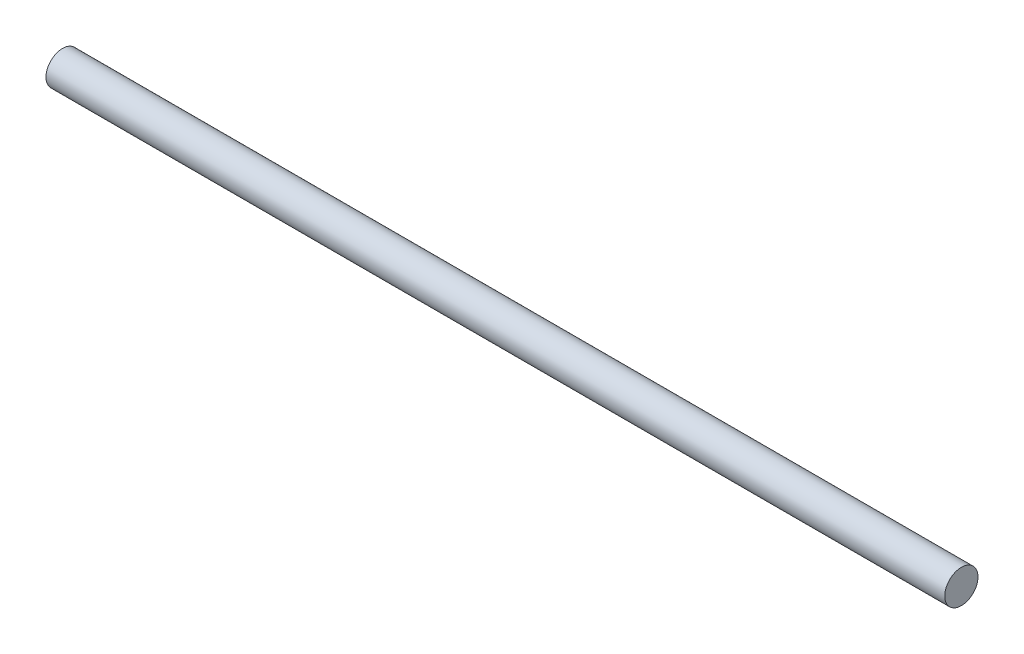
from build123d import *

# Parameters (mm, degrees)
SKETCH1_R           = 11.1
BOSS_EXTRUDE1_DEPTH = 300


with BuildPart() as part:
    # Sketch1 → Boss-Extrude1 (new, symmetric)
    with BuildSketch(Plane(origin=(0, 0, 0), x_dir=(0, 0, -1), z_dir=(1, 0, 0))):
        Circle(SKETCH1_R)
    extrude(amount=BOSS_EXTRUDE1_DEPTH, both=True)


solid = part.part
